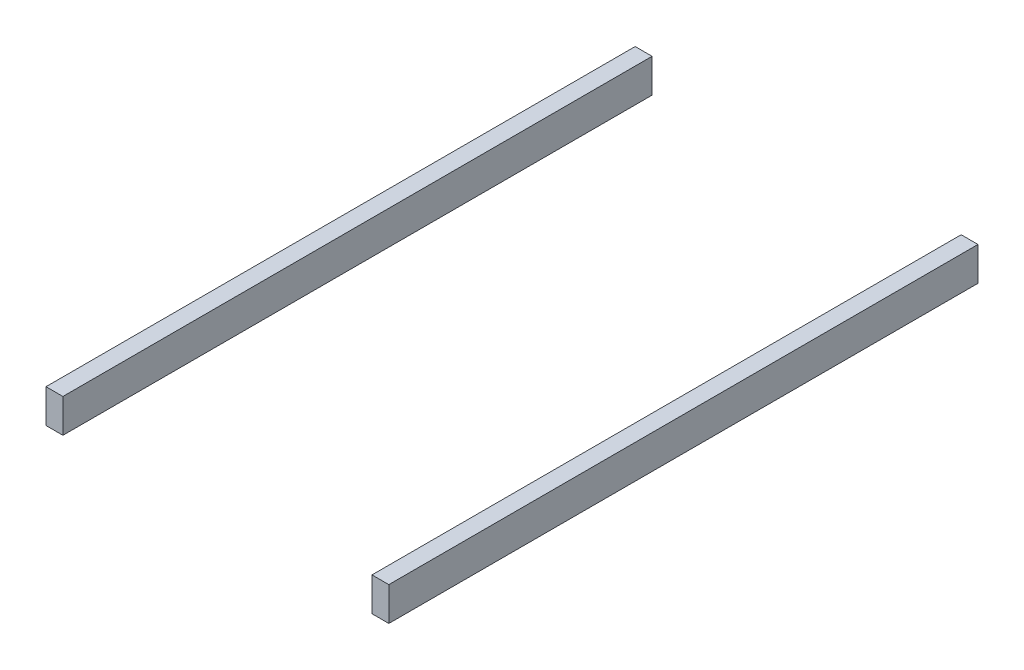
from build123d import *

# Parameters (mm, degrees)
SKETCH1_W             = 100
SKETCH1_H             = 200
BOSS_EXTRUDE1_DEPTH   = 3500
SKETCH1_W_2           = 100.508735643
BOSS_EXTRUDE1_2_DEPTH = 3500


with BuildPart() as part:
    # Sketch1 → Boss-Extrude1 (new body)
    with BuildSketch(Plane.XY):
        with Locations((1950.944959248, -60.332710944)):
            Rectangle(SKETCH1_W, SKETCH1_H)
    extrude(amount=BOSS_EXTRUDE1_DEPTH)


with BuildPart() as body_2:
    # Sketch1 → Boss-Extrude1 2 (new body)
    with BuildSketch(Plane.XY):
        with Locations((14.690591426, -60.332710944)):
            Rectangle(SKETCH1_W_2, SKETCH1_H)
    extrude(amount=BOSS_EXTRUDE1_2_DEPTH)


solid = Compound([part.part, body_2.part])
